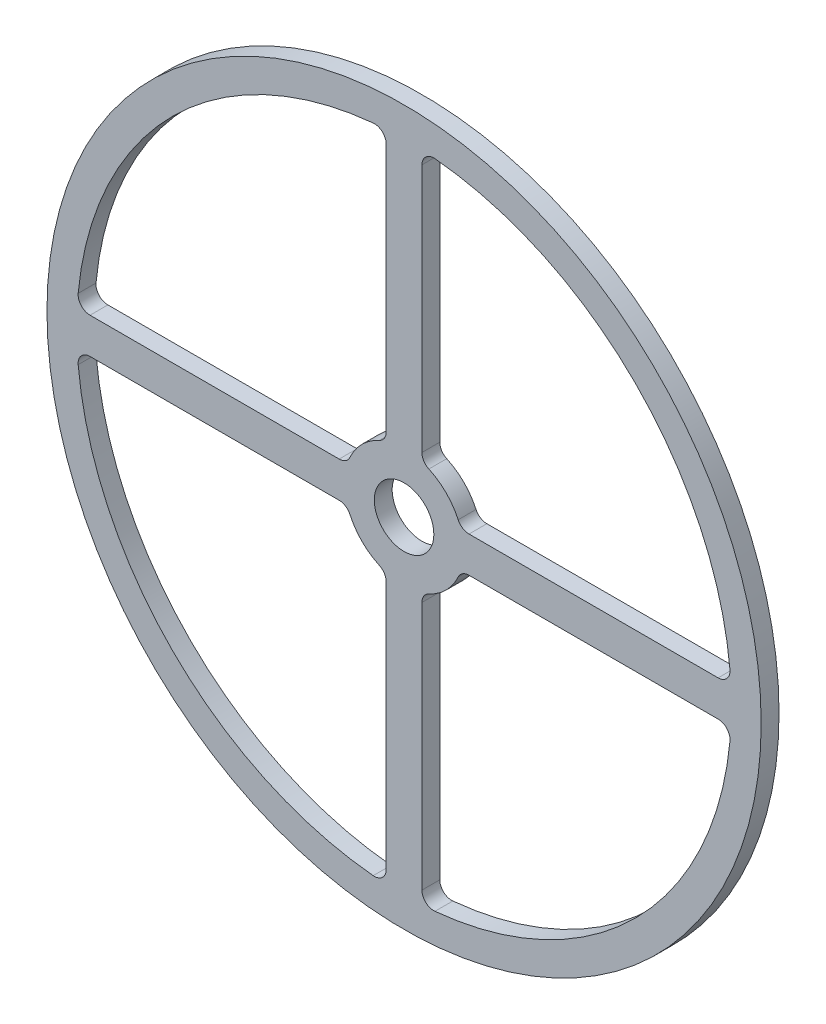
from build123d import *

# Parameters (mm, degrees)
SKETCH_1_R      = 60
SKETCH_1_R_2    = 5
EXTRUDE_1_DEPTH = 3
FILLET_1_R      = 2
FILLET_2_R      = 2
FILLET_4_R      = 2


with BuildPart() as part:
    # 草图1 → 凸台-拉伸1 (new body)
    with BuildSketch(Plane.XY):
        Circle(SKETCH_1_R)
        Circle(SKETCH_1_R_2, mode=Mode.SUBTRACT)
        with BuildLine():
            Line((3, 54.918120871), (3, 9.539392014))
            ThreePointArc((3, 9.539392014), (7.071067812, 7.071067812), (9.539392014, 3))
            Line((9.539392014, 3), (54.918120871, 3))
            ThreePointArc((54.918120871, 3), (38.890872965, 38.890872965), (3, 54.918120871))
        make_face(mode=Mode.SUBTRACT)
        with BuildLine():
            Line((-9.539392014, -3), (-54.918120871, -3))
            ThreePointArc((-54.918120871, -3), (-38.890872965, -38.890872965), (-3, -54.918120871))
            Line((-3, -54.918120871), (-3, -9.539392014))
            ThreePointArc((-3, -9.539392014), (-7.071067812, -7.071067812), (-9.539392014, -3))
        make_face(mode=Mode.SUBTRACT)
        with BuildLine():
            Line((9.539392014, -3), (54.918120871, -3))
            ThreePointArc((54.918120871, -3), (38.890872965, -38.890872965), (3, -54.918120871))
            Line((3, -54.918120871), (3, -9.539392014))
            ThreePointArc((3, -9.539392014), (7.071067812, -7.071067812), (9.539392014, -3))
        make_face(mode=Mode.SUBTRACT)
        with BuildLine():
            Line((-3, 9.539392014), (-3, 54.918120871))
            ThreePointArc((-3, 54.918120871), (-38.890872965, 38.890872965), (-54.918120871, 3))
            Line((-54.918120871, 3), (-9.539392014, 3))
            ThreePointArc((-9.539392014, 3), (-7.071067812, 7.071067812), (-3, 9.539392014))
        make_face(mode=Mode.SUBTRACT)
    extrude(amount=EXTRUDE_1_DEPTH)

    # 圆角1
    fillet_1_edges = [part.edges().sort_by_distance(p)[0] for p in [
        (3, 54.918120871, 1.5),
    ]]
    fillet(fillet_1_edges, radius=FILLET_1_R)

    # 圆角2
    fillet_2_edges = [part.edges().sort_by_distance(p)[0] for p in [
        (54.918120871, 3, 1.5),
        (3, -54.918120871, 1.5),
        (54.918120871, -3, 1.5),
        (-54.918120871, -3, 1.5),
        (-3, -54.918120871, 1.5),
        (-3, 54.918120871, 1.5),
        (-54.918120871, 3, 1.5),
    ]]
    fillet(fillet_2_edges, radius=FILLET_2_R)

    # 圆角4
    fillet_4_edges = [part.edges().sort_by_distance(p)[0] for p in [
        (3, 9.539392014, 1.5),
        (9.539392014, 3, 1.5),
        (9.539392014, -3, 1.5),
        (3, -9.539392014, 1.5),
        (-3, -9.539392014, 1.5),
        (-9.539392014, -3, 1.5),
        (-9.539392014, 3, 1.5),
        (-3, 9.539392014, 1.5),
    ]]
    fillet(fillet_4_edges, radius=FILLET_4_R)


solid = part.part
